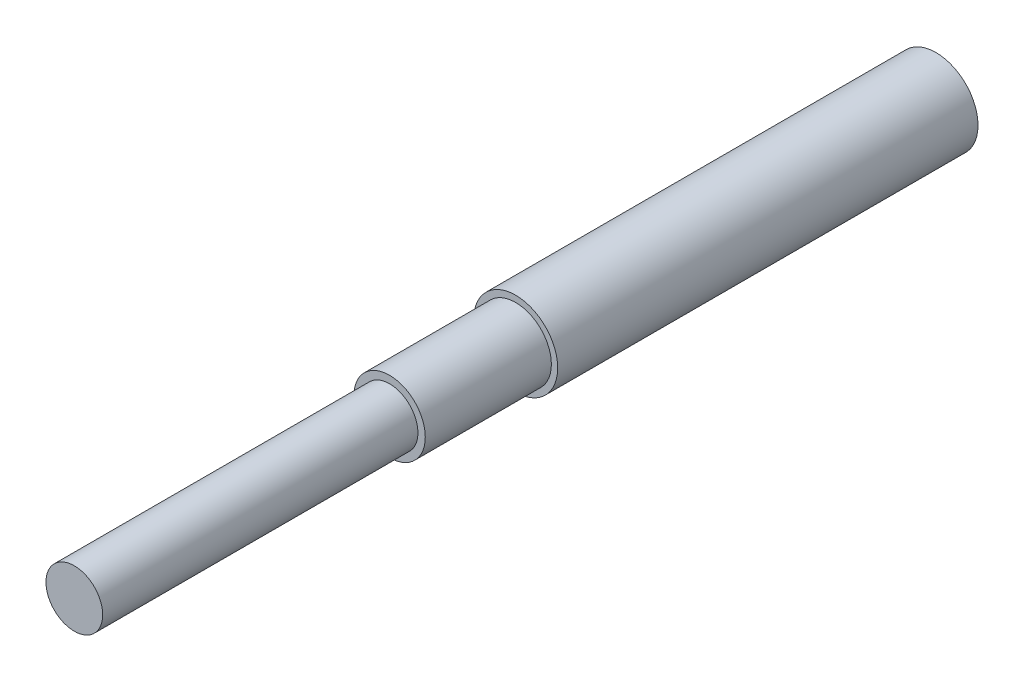
from build123d import *

# Parameters (mm, degrees)
ESQUISSE1_R        = 2
BOSS_EXTRU_1_DEPTH = 20
ESQUISSE8_R        = 1.7
BOSS_EXTRU_2_DEPTH = 6
ESQUISSE9_R        = 1.35
BOSS_EXTRU_3_DEPTH = 15


with BuildPart() as part:
    # Esquisse1 → Boss.-Extru.1 (new body)
    with BuildSketch(Plane.XY):
        Circle(ESQUISSE1_R)
    extrude(amount=BOSS_EXTRU_1_DEPTH)

    # Esquisse8 → Boss.-Extru.2 (add)
    with BuildSketch(Plane.XY.offset(20)):
        Circle(ESQUISSE8_R)
    extrude(amount=BOSS_EXTRU_2_DEPTH)

    # Esquisse9 → Boss.-Extru.3 (add)
    with BuildSketch(Plane.XY.offset(26)):
        Circle(ESQUISSE9_R)
    extrude(amount=BOSS_EXTRU_3_DEPTH)


solid = part.part
